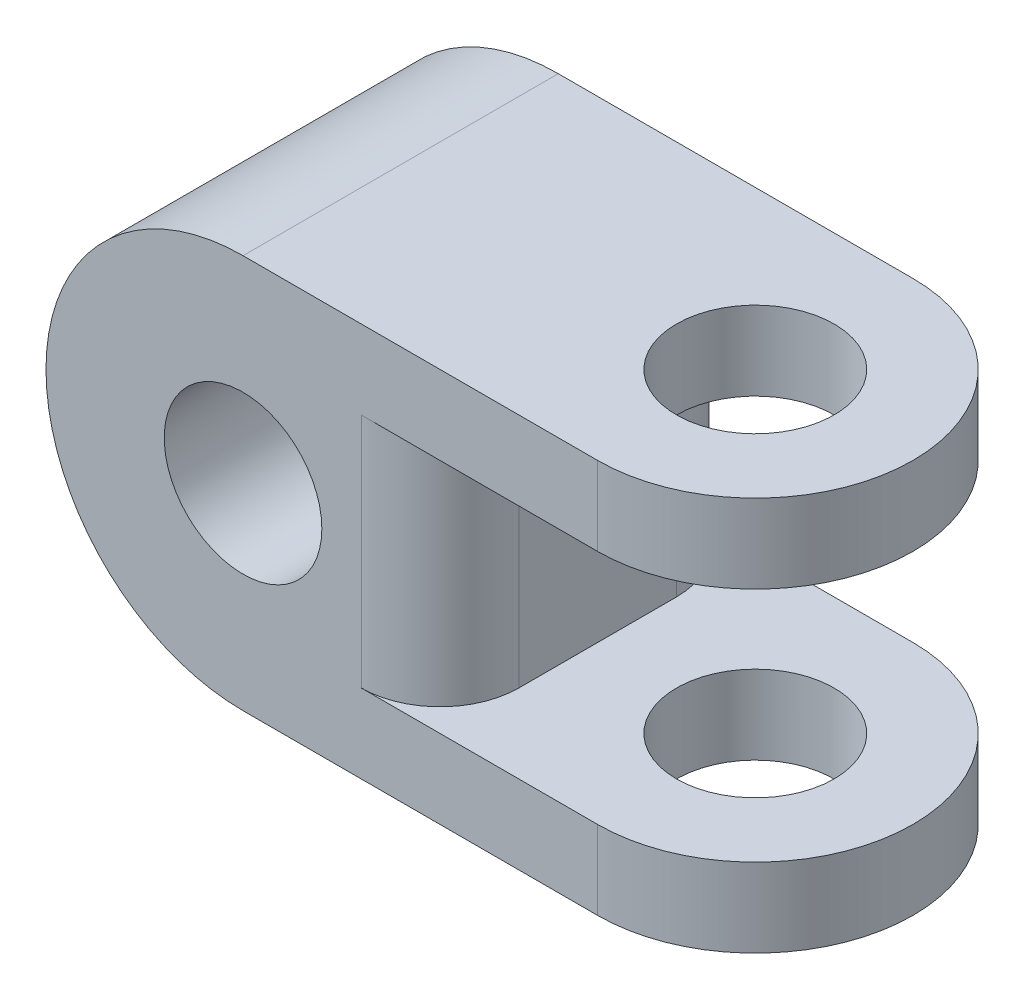
from build123d import *

# Parameters (mm, degrees)
SKETCH1_R           = 10
BOSS_EXTRUDE1_DEPTH = 20
FILLET1_R           = 10
CUT_EXTRUDE1_REACH  = 106.881
SKETCH2_R           = 10
CUT_EXTRUDE2_REACH  = 106.881
SKETCH2_2_R         = 10
FILLET2_RADIUS      = 20
FILLET2_LENGTH      = 10
FILLET3_RADIUS      = 20
FILLET3_LENGTH      = 10


with BuildPart() as part:
    # Sketch1 → Boss-Extrude1 (new, symmetric)
    with BuildSketch(Plane.XY):
        with BuildLine():
            Line((0, 0), (0, 10))
            Line((0, 10), (-65, 10))
            ThreePointArc((-65, 10), (-90, -15), (-65, -40))
            Line((-65, -40), (0, -40))
            Line((0, -40), (0, -30))
            Line((0, -30), (-40, -30))
            Line((-40, -30), (-40, 0))
            Line((-40, 0), (0, 0))
        make_face()
        with Locations((-65, -15)):
            Circle(SKETCH1_R, mode=Mode.SUBTRACT)
    extrude(amount=BOSS_EXTRUDE1_DEPTH, both=True)

    # Fillet1
    fillet1_edges = [part.edges().sort_by_distance(p)[0] for p in [
        (-40, -15, -20),
        (-40, -15, 20),
    ]]
    fillet(fillet1_edges, radius=FILLET1_R)

    # Sketch2 → Cut-Extrude1 (cut, up to next)
    with BuildSketch(Plane(origin=(0, 10, 0), x_dir=(1, 0, 0), z_dir=(0, 1, 0)), mode=Mode.PRIVATE) as cut_extrude1_sk1:
        with Locations(Location((-20, 0, 0), (0, 0, 180))):
            Circle(SKETCH2_R)
    cut_extrude1_tool1 = extrude(cut_extrude1_sk1.sketch, amount=-CUT_EXTRUDE1_REACH, mode=Mode.PRIVATE) & part.part
    add(cut_extrude1_tool1.solids().sort_by_distance((-20, 10, 0))[0], mode=Mode.SUBTRACT)

    # Sketch2<2> → Cut-Extrude2 (cut, up to next)
    with BuildSketch(Plane(origin=(0, 10, 0), x_dir=(1, 0, 0), z_dir=(0, 1, 0)), mode=Mode.PRIVATE) as cut_extrude2_sk1:
        with Locations(Location((-20, 0, 0), (0, 0, 180))):
            Circle(SKETCH2_2_R)
    cut_extrude2_tool1 = extrude(cut_extrude2_sk1.sketch, amount=-CUT_EXTRUDE2_REACH, mode=Mode.PRIVATE) & part.part
    add(cut_extrude2_tool1.solids().sort_by_distance((-20, 10, 0))[0], mode=Mode.SUBTRACT)

    # Fillet2: full round fillet: the end face becomes a half cylinder, R = half its width
    fillet2_face = Plane((0, -35, 0), x_dir=(0, -1, 0), z_dir=(1, 0, 0))  # on the end face: x along it, z out of the body
    fillet2_slab = fillet2_face.offset(-FILLET2_RADIUS / 2) * Box(FILLET2_LENGTH, 2 * FILLET2_RADIUS, FILLET2_RADIUS, mode=Mode.PRIVATE)  # the body's end, R deep
    fillet2_round = Plane((-20, -35, 0), x_dir=(1, 0, 0), z_dir=(0, -1, 0)) * Cylinder(FILLET2_RADIUS, FILLET2_LENGTH, mode=Mode.PRIVATE)  # its axis R under the face
    add(fillet2_slab - fillet2_round, mode=Mode.SUBTRACT)

    # Fillet3: full round fillet: the end face becomes a half cylinder, R = half its width
    fillet3_face = Plane((0, 5, 0), x_dir=(0, 1, 0), z_dir=(1, 0, 0))  # on the end face: x along it, z out of the body
    fillet3_slab = fillet3_face.offset(-FILLET3_RADIUS / 2) * Box(FILLET3_LENGTH, 2 * FILLET3_RADIUS, FILLET3_RADIUS, mode=Mode.PRIVATE)  # the body's end, R deep
    fillet3_round = Plane((-20, 5, 0), x_dir=(1, 0, 0), z_dir=(0, 1, 0)) * Cylinder(FILLET3_RADIUS, FILLET3_LENGTH, mode=Mode.PRIVATE)  # its axis R under the face
    add(fillet3_slab - fillet3_round, mode=Mode.SUBTRACT)


solid = part.part
